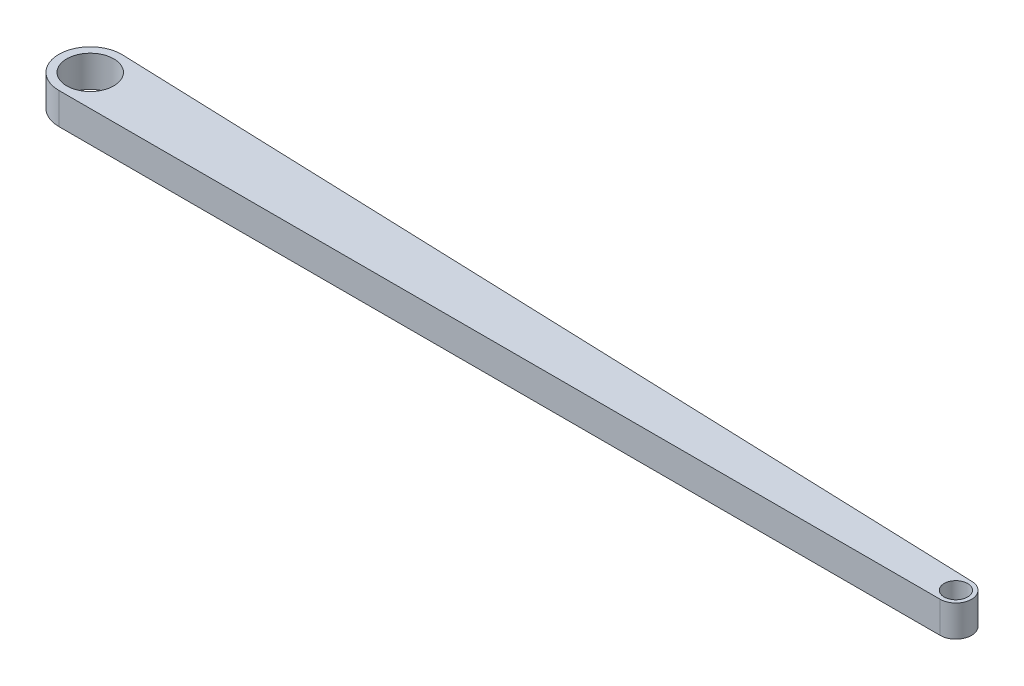
from build123d import *

# Parameters (mm, degrees)
BOSS_EXTRUDE1_DEPTH = 64


with BuildPart() as part:
    # Sketch1 → Boss-Extrude1 (new body)
    with BuildSketch(Plane(origin=(0, 0, 0), x_dir=(1, 0, 0), z_dir=(0, 1, 0))):
        with BuildLine():
            ThreePointArc((64, 64), (45.254833996, 18.745166004), (0, 0))
            Line((0, 0), (1800, 0))
            ThreePointArc((1800, 0), (1768, 32), (1800, 64))
            Line((1800, 64), (4.545364872, 127.838387027))
            ThreePointArc((4.545364872, 127.838387027), (46.834300207, 107.618210923), (64, 64))
        make_face()
        with BuildLine():
            ThreePointArc((0, 128), (-64, 64), (0, 0))
            Line((0, 0), (0, 16))
            ThreePointArc((0, 16), (-48, 64), (0, 112))
            Line((0, 112), (0, 128))
        make_face()
        with BuildLine():
            Line((0, 16), (0, 0))
            ThreePointArc((0, 0), (45.254833996, 18.745166004), (64, 64))
            ThreePointArc((64, 64), (46.834300207, 107.618210923), (4.545364872, 127.838387027))
            Line((4.545364872, 127.838387027), (0, 128))
            Line((0, 128), (0, 112))
            ThreePointArc((0, 112), (33.941125497, 97.941125497), (48, 64))
            ThreePointArc((48, 64), (33.941125497, 30.058874503), (0, 16))
        make_face()
        with BuildLine():
            ThreePointArc((1800, 64), (1768, 32), (1800, 0))
            Line((1800, 0), (1800, 8))
            ThreePointArc((1800, 8), (1776, 32), (1800, 56))
            Line((1800, 56), (1800, 64))
        make_face()
        with BuildLine():
            Line((1800, 8), (1800, 0))
            ThreePointArc((1800, 0), (1822.627416998, 9.372583002), (1832, 32))
            ThreePointArc((1832, 32), (1822.627416998, 54.627416998), (1800, 64))
            Line((1800, 64), (1800, 56))
            ThreePointArc((1800, 56), (1816.970562748, 48.970562748), (1824, 32))
            ThreePointArc((1824, 32), (1816.970562748, 15.029437252), (1800, 8))
        make_face()
    extrude(amount=BOSS_EXTRUDE1_DEPTH)


solid = part.part
